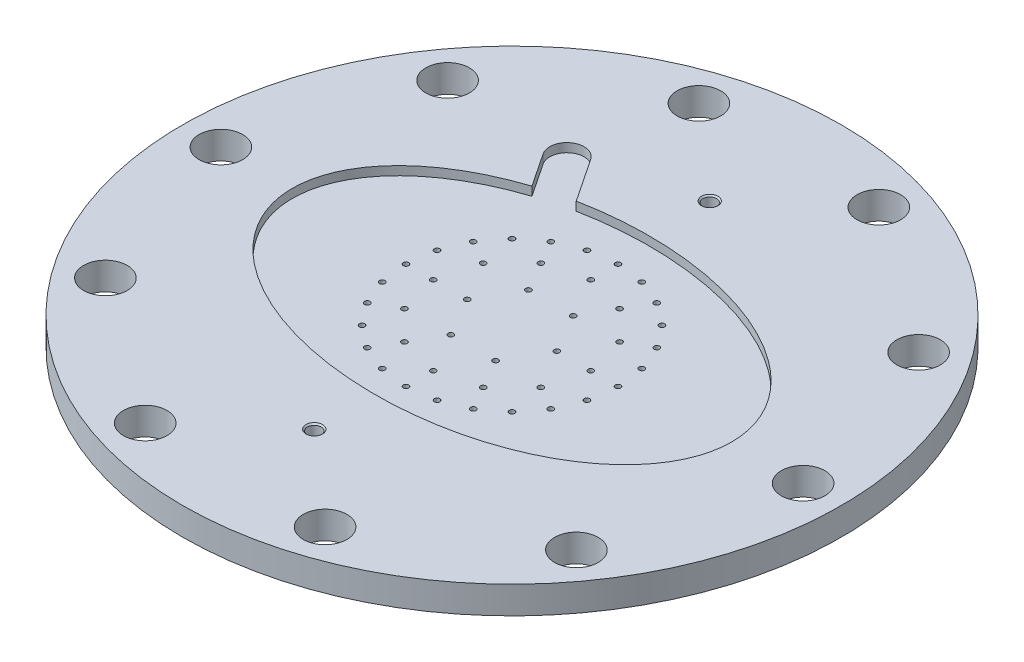
from build123d import *

# Parameters (mm, degrees)
F_3_8_CLEARANCE_HOLE1_D                = 10.0838
CIRPATTERN1_COUNT                      = 10
SKETCH5_RX                             = 50.8
SKETCH5_RY                             = 31.75
CUT_EXTRUDE1_DEPTH                     = 2.032
SKETCH6_R                              = 0.635
CUT_EXTRUDE2_DEPTH                     = 108.849548557
F_1_8_0_125_DIAMETER_HOLE1_D           = 3.175
F_1_8_0_125_DIAMETER_HOLE1_DEPTH       = 2.856133767
F_1_8_0_125_DIAMETER_HOLE1_CSINK_D     = 3.81
F_1_8_0_125_DIAMETER_HOLE1_CSINK_ANGLE = 90
F_1_8_0_125_DIAMETER_HOLE1_TIP         = 0.953866233


with BuildPart() as part:
    # Sketch1 → Revolve1 (revolve)
    with BuildSketch(Plane.XY, mode=Mode.PRIVATE) as revolve1_sk:
        Polygon((0, -6.35), (54.8259, -6.35), (54.8259, -3.6576), (58.8899, -3.6576), (58.8899, -6.35), (76.2, -6.35), (76.2, 0), (0, 0), align=None)
    revolve(revolve1_sk.sketch.rotate(Axis((0, 0, 0), (0, -1, 0)), 90), axis=Axis((0, 0, 0), (0, -1, 0)))

    # 3/8 Clearance Hole1 (through all)
    with Locations(Plane(origin=(67.31, 0, 0), x_dir=(0, 0, 1), z_dir=(0, 1, 0))):
        with Locations((0, 0)):
            f_3_8_clearance_hole1 = Hole(F_3_8_CLEARANCE_HOLE1_D / 2)

    # CirPattern1: 3/8 Clearance Hole1 ×10 about axis
    cirpattern1_axis = Axis((0, 0, 0), (0, 1, 0))
    for i in range(1, CIRPATTERN1_COUNT):
        add(f_3_8_clearance_hole1.rotate(cirpattern1_axis, i * 360 / CIRPATTERN1_COUNT), mode=Mode.SUBTRACT)

    # Sketch5 → Cut-Extrude1 (cut)
    with BuildSketch(Plane(origin=(0, 0, 0), x_dir=(1, 0, 0), z_dir=(0, 1, 0))):
        with Locations((0, 0)):
            Ellipse(SKETCH5_RX, SKETCH5_RY)
        with BuildLine():
            Line((-3.302199606, -2.201466404), (-28.702199606, 35.898533596))
            ThreePointArc((-28.702199606, 35.898533596), (-27.601466404, 41.402199606), (-22.097800394, 40.301466404))
            Line((-22.097800394, 40.301466404), (3.302199606, 2.201466404))
            ThreePointArc((3.302199606, 2.201466404), (2.201466404, -3.302199606), (-3.302199606, -2.201466404))
        make_face()
    extrude(amount=-CUT_EXTRUDE1_DEPTH, mode=Mode.SUBTRACT)

    # Sketch6 → Cut-Extrude2 (cut, through all)
    with BuildSketch(Plane(origin=(0, -2.032, 0), x_dir=(1, 0, 0), z_dir=(0, 1, 0))):
        with Locations(Location((-5.1816, -8.974794464, 0), (0, 0, 270))):
            Circle(SKETCH6_R)
        with Locations(Location((5.1816, -8.974794464, 0), (0, 0, 270))):
            Circle(SKETCH6_R)
        with Locations(Location((24.511, 0, 0), (0, 0, 270))):
            Circle(SKETCH6_R)
        with Locations(Location((18.2118, 0, 0), (0, 0, 270))):
            Circle(SKETCH6_R)
        with Locations(Location((10.3632, 0, 0), (0, 0, 270))):
            Circle(SKETCH6_R)
        with Locations(Location((0, -18.2118, 0), (0, 0, 270))):
            Circle(SKETCH6_R)
        with Locations(Location((9.1059, -15.771881449, 0), (0, 0, 270))):
            Circle(SKETCH6_R)
        with Locations(Location((15.771881449, -9.1059, 0), (0, 0, 270))):
            Circle(SKETCH6_R)
        with Locations(Location((5.1816, 8.974794464, 0), (0, 0, 270))):
            Circle(SKETCH6_R)
        with Locations(Location((-5.1816, 8.974794464, 0), (0, 0, 270))):
            Circle(SKETCH6_R)
        with Locations(Location((-10.3632, 0, 0), (0, 0, 270))):
            Circle(SKETCH6_R)
        with Locations(Location((15.771881449, 9.1059, 0), (0, 0, 270))):
            Circle(SKETCH6_R)
        with Locations(Location((9.1059, 15.771881449, 0), (0, 0, 270))):
            Circle(SKETCH6_R)
        with Locations(Location((0, 18.2118, 0), (0, 0, 270))):
            Circle(SKETCH6_R)
        with Locations(Location((-9.1059, 15.771881449, 0), (0, 0, 270))):
            Circle(SKETCH6_R)
        with Locations(Location((-15.771881449, 9.1059, 0), (0, 0, 270))):
            Circle(SKETCH6_R)
        with Locations(Location((-18.2118, 0, 0), (0, 0, 270))):
            Circle(SKETCH6_R)
        with Locations(Location((-15.771881449, -9.1059, 0), (0, 0, 270))):
            Circle(SKETCH6_R)
        with Locations(Location((-9.1059, -15.771881449, 0), (0, 0, 270))):
            Circle(SKETCH6_R)
        with Locations(Location((-6.343913615, -23.675807928, 0), (0, 0, 270))):
            Circle(SKETCH6_R)
        with Locations(Location((0, -24.511, 0), (0, 0, 270))):
            Circle(SKETCH6_R)
        with Locations(Location((6.343913615, -23.675807928, 0), (0, 0, 270))):
            Circle(SKETCH6_R)
        with Locations(Location((12.2555, -21.227148672, 0), (0, 0, 270))):
            Circle(SKETCH6_R)
        with Locations(Location((17.331894314, -17.331894314, 0), (0, 0, 270))):
            Circle(SKETCH6_R)
        with Locations(Location((21.227148672, -12.2555, 0), (0, 0, 270))):
            Circle(SKETCH6_R)
        with Locations(Location((23.675807928, -6.343913615, 0), (0, 0, 270))):
            Circle(SKETCH6_R)
        with Locations(Location((-17.331894314, 17.331894314, 0), (0, 0, 270))):
            Circle(SKETCH6_R)
        with Locations(Location((-21.227148672, 12.2555, 0), (0, 0, 270))):
            Circle(SKETCH6_R)
        with Locations(Location((-23.675807928, 6.343913615, 0), (0, 0, 270))):
            Circle(SKETCH6_R)
        with Locations(Location((-24.511, 0, 0), (0, 0, 270))):
            Circle(SKETCH6_R)
        with Locations(Location((-23.675807928, -6.343913615, 0), (0, 0, 270))):
            Circle(SKETCH6_R)
        with Locations(Location((-21.227148672, -12.2555, 0), (0, 0, 270))):
            Circle(SKETCH6_R)
        with Locations(Location((-17.331894314, -17.331894314, 0), (0, 0, 270))):
            Circle(SKETCH6_R)
        with Locations(Location((-12.2555, -21.227148672, 0), (0, 0, 270))):
            Circle(SKETCH6_R)
        with Locations(Location((23.675807928, 6.343913615, 0), (0, 0, 270))):
            Circle(SKETCH6_R)
        with Locations(Location((21.227148672, 12.2555, 0), (0, 0, 270))):
            Circle(SKETCH6_R)
        with Locations(Location((17.331894314, 17.331894314, 0), (0, 0, 270))):
            Circle(SKETCH6_R)
        with Locations(Location((12.2555, 21.227148672, 0), (0, 0, 270))):
            Circle(SKETCH6_R)
        with Locations(Location((6.343913615, 23.675807928, 0), (0, 0, 270))):
            Circle(SKETCH6_R)
        with Locations(Location((0, 24.511, 0), (0, 0, 270))):
            Circle(SKETCH6_R)
        with Locations(Location((-6.343913615, 23.675807928, 0), (0, 0, 270))):
            Circle(SKETCH6_R)
        with Locations(Location((-12.2555, 21.227148672, 0), (0, 0, 270))):
            Circle(SKETCH6_R)
    extrude(amount=-CUT_EXTRUDE2_DEPTH, mode=Mode.SUBTRACT)

    # 1/8 (0.125) Diameter Hole1
    with Locations(Plane(origin=(0, 0, -45.72), x_dir=(0, 0, 1), z_dir=(0, 1, 0))):
        with Locations((0, 0), (91.44, 0)):
            CounterSinkHole(F_1_8_0_125_DIAMETER_HOLE1_D / 2, F_1_8_0_125_DIAMETER_HOLE1_CSINK_D / 2, depth=F_1_8_0_125_DIAMETER_HOLE1_DEPTH, counter_sink_angle=F_1_8_0_125_DIAMETER_HOLE1_CSINK_ANGLE)
            with Locations((0, 0, -(F_1_8_0_125_DIAMETER_HOLE1_DEPTH + F_1_8_0_125_DIAMETER_HOLE1_TIP / 2))):  # 118° drill point
                Cone(0, F_1_8_0_125_DIAMETER_HOLE1_D / 2, F_1_8_0_125_DIAMETER_HOLE1_TIP, mode=Mode.SUBTRACT)


solid = part.part
